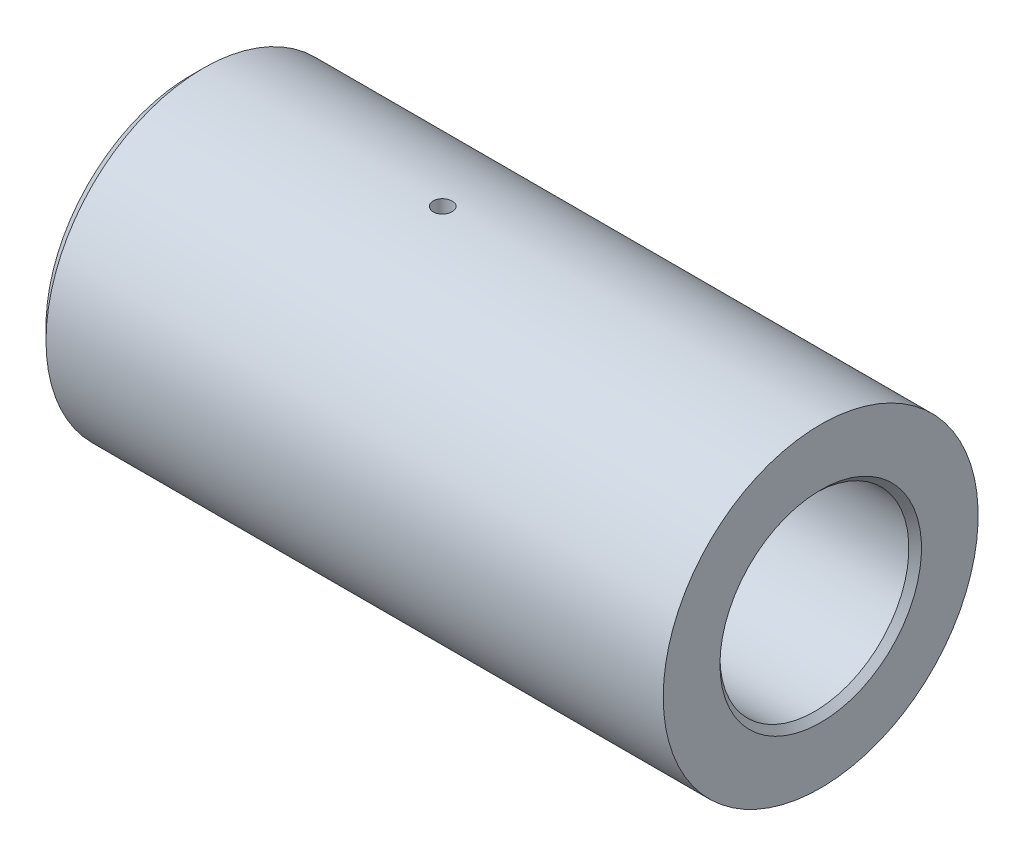
from build123d import *

# Parameters (mm, degrees)
RACCORDO1_R    = 3
SMUSSO1_SIZE   = 2
SMUSSO2_SIZE   = 1
FORO_3_0_3_1_D = 3


with BuildPart() as part:
    # Schizzo2 → Rivoluzione1 (revolve)
    with BuildSketch(Plane.XY, mode=Mode.PRIVATE) as rivoluzione1_sk:
        Polygon((0, 10), (0, 25), (100, 25), (100, 15), (65, 15), (65, 18), (60, 18), (60, 15), (25, 15), (25, 10), align=None)
    revolve(rivoluzione1_sk.sketch.rotate(Axis((0, 0, 0), (1, 0, 0)), 90), axis=Axis((0, 0, 0), (1, 0, 0)))

    # Raccordo1
    raccordo1_edges = [part.edges().sort_by_distance(p)[0] for p in [
        (25, 0, -15),
    ]]
    fillet(raccordo1_edges, radius=RACCORDO1_R)

    # Smusso1
    smusso1_edges = [part.edges().sort_by_distance(p)[0] for p in [
        (0, 0, -25),
    ]]
    chamfer(smusso1_edges, length=SMUSSO1_SIZE)

    # Smusso2
    smusso2_edges = [part.edges().sort_by_distance(p)[0] for p in [
        (100, 0, -15),
        (0, 0, -10),
    ]]
    chamfer(smusso2_edges, length=SMUSSO2_SIZE)

    # Foro Ø3.0 (3)-1 (through all)
    with Locations(Plane(origin=(0, 25, 0), x_dir=(1, 0, 0), z_dir=(0, 1, 0))):
        with Locations((40, 0)):
            Hole(FORO_3_0_3_1_D / 2)


solid = part.part
